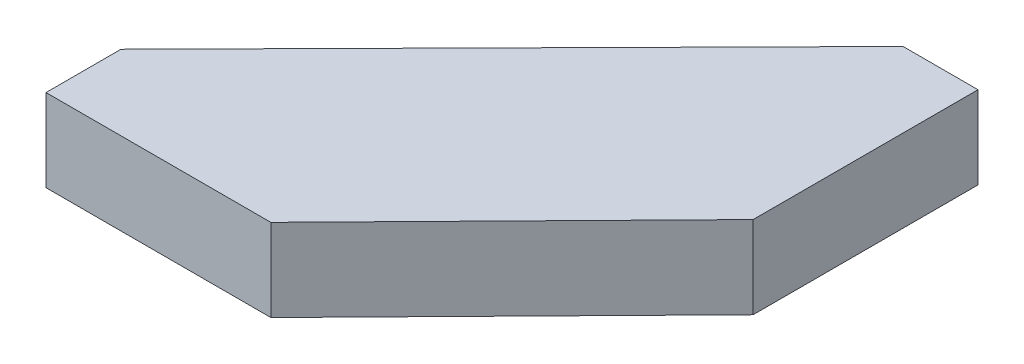
from build123d import *

# Parameters (mm, degrees)
BOSS_EXTRUDE2_DEPTH = 4.4


with BuildPart() as part:
    # Sketch1 → Boss-Extrude2 (new body)
    with BuildSketch(Plane(origin=(0, 0, 0), x_dir=(1, 0, 0), z_dir=(0, 1, 0))):
        Polygon((-15.400633484, -14.303167421), (-3.400633484, -14.303167421), (9.339366516, -1.303167421), (9.339366516, 10.696832579), (5.339366516, 10.696832579), (-15.400633484, -10.303167421), align=None)
    extrude(amount=BOSS_EXTRUDE2_DEPTH)


solid = part.part
